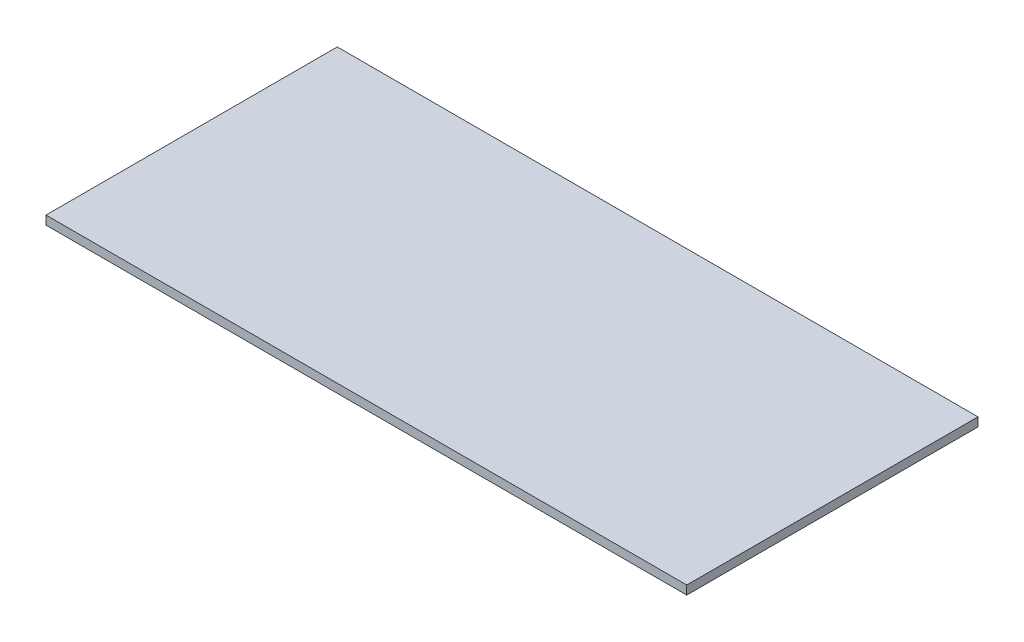
from build123d import *

# Parameters (mm, degrees)
SKETCH1_W           = 220
SKETCH1_H           = 100
BOSS_EXTRUDE1_DEPTH = 3


with BuildPart() as part:
    # Sketch1 → Boss-Extrude1 (new body)
    with BuildSketch(Plane(origin=(0, 0, 0), x_dir=(1, 0, 0), z_dir=(0, 1, 0))):
        with Locations((110, 50)):
            Rectangle(SKETCH1_W, SKETCH1_H)
    extrude(amount=BOSS_EXTRUDE1_DEPTH)


solid = part.part
